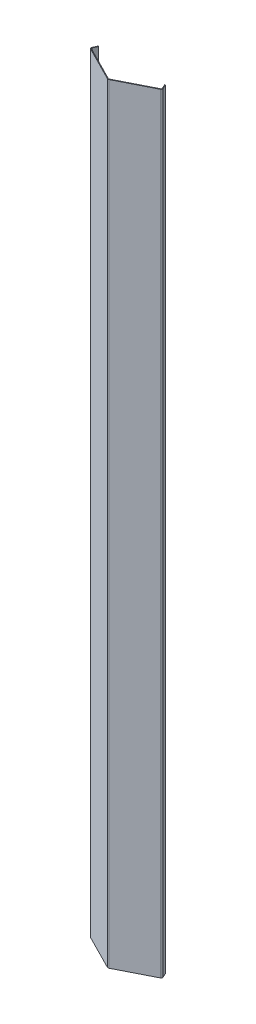
from build123d import *

# Parameters (mm, degrees)
BOSS_EXTRUDE2_DEPTH = 4830


with BuildPart() as part:
    # Sketch1 → Boss-Extrude2 (new body)
    with BuildSketch(Plane(origin=(0, 0, 0), x_dir=(1, 0, 0), z_dir=(0, 1, 0))):
        with BuildLine():
            Line((319.222222222, 134.965277778), (331.494858512, 107.65046142))
            ThreePointArc((331.494858512, 107.65046142), (331.801527991, 100.219250383), (326.892771492, 94.631670113))
            Line((326.892771492, 94.631670113), (112.709917293, -13.883323219))
            ThreePointArc((112.709917293, -13.883323219), (108.190412513, -14.962892929), (103.670907733, -13.883323219))
            Line((103.670907733, -13.883323219), (-110.511946465, 94.631670113))
            ThreePointArc((-110.511946465, 94.631670113), (-115.420702964, 100.219250383), (-115.114033485, 107.65046142))
            Line((-115.114033485, 107.65046142), (-102.841397196, 134.965277778))
            Line((-102.841397196, 134.965277778), (-99.192760475, 133.325933371))
            Line((-99.192760475, 133.325933371), (-111.465396765, 106.011117013))
            ThreePointArc((-111.465396765, 106.011117013), (-111.649398452, 101.552390391), (-108.704144553, 98.199842229))
            Line((-108.704144553, 98.199842229), (105.478709645, -10.315151103))
            ThreePointArc((105.478709645, -10.315151103), (108.190412513, -10.962892929), (110.902115381, -10.315151103))
            Line((110.902115381, -10.315151103), (325.08496958, 98.199842229))
            ThreePointArc((325.08496958, 98.199842229), (328.030223479, 101.552390391), (327.846221792, 106.011117013))
            Line((327.846221792, 106.011117013), (315.573585502, 133.325933371))
            Line((315.573585502, 133.325933371), (319.222222222, 134.965277778))
        make_face()
    extrude(amount=BOSS_EXTRUDE2_DEPTH)


solid = part.part
